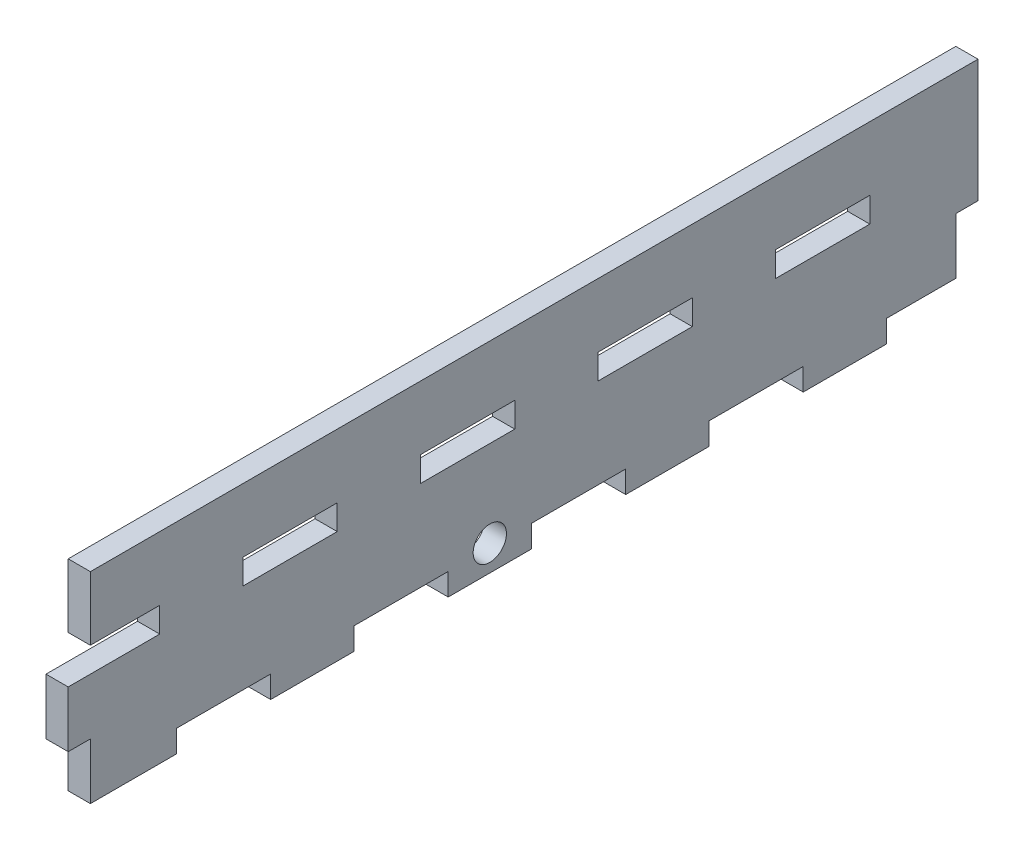
from build123d import *

# Parameters (mm, degrees)
ESQUISSE1_W             = 82
ESQUISSE1_H             = 12.11
BOSS_EXTRU_1_DEPTH      = 2
ESQUISSE2_W             = 8.5
ESQUISSE2_H             = 2.25
ENL_V_MAT_EXTRU_1_DEPTH = 42.581069992
ESQUISSE3_W             = 8.5
ESQUISSE3_H             = 2
ENL_V_MAT_EXTRU_2_DEPTH = 42.581069992
ESQUISSE4_W             = 2
ESQUISSE4_H             = 5.055
ENL_V_MAT_EXTRU_3_DEPTH = 42.581069992
ESQUISSE5_W             = 80
ESQUISSE5_H             = 6
BOSS_EXTRU_2_DEPTH      = 2
ESQUISSE6_W             = 6.25
ESQUISSE6_H             = 0.25
ESQUISSE6_W_2           = 8.5
ENL_V_MAT_EXTRU_4_DEPTH = 43.867766231
SKETCH1_R               = 1.5
CUT_EXTRUDE1_DEPTH      = 43.867766231


with BuildPart() as part:
    # Esquisse1 → Boss.-Extru.1 (new body)
    with BuildSketch(Plane(origin=(0, 0, 0), x_dir=(0, 0, -1), z_dir=(1, 0, 0))):
        with Locations((-0.0892, 0)):
            Rectangle(ESQUISSE1_W, ESQUISSE1_H)
    extrude(amount=BOSS_EXTRU_1_DEPTH)

    # Esquisse2 → Enlèv. mat.-Extru.1 (cut, through all)
    with BuildSketch(Plane(origin=(0, 0, 0), x_dir=(0, 0, -1), z_dir=(1, 0, 0))):
        with Locations((-37.0892, 5.18)):
            Rectangle(ESQUISSE2_W, ESQUISSE2_H)
        with Locations((-21.0892, 5.18)):
            Rectangle(ESQUISSE2_W, ESQUISSE2_H)
        with Locations((-5.0892, 5.18)):
            Rectangle(ESQUISSE2_W, ESQUISSE2_H)
        with Locations((10.9108, 5.18)):
            Rectangle(ESQUISSE2_W, ESQUISSE2_H)
        with Locations((26.9108, 5.18)):
            Rectangle(ESQUISSE2_W, ESQUISSE2_H)
    extrude(amount=ENL_V_MAT_EXTRU_1_DEPTH, mode=Mode.SUBTRACT)

    # Esquisse3 → Enlèv. mat.-Extru.2 (cut, through all)
    with BuildSketch(Plane(origin=(0, 0, 0), x_dir=(0, 0, -1), z_dir=(1, 0, 0))):
        with Locations((-27.0892, -5.055)):
            Rectangle(ESQUISSE3_W, ESQUISSE3_H)
        with Locations((-11.0892, -5.055)):
            Rectangle(ESQUISSE3_W, ESQUISSE3_H)
        with Locations((4.9108, -5.055)):
            Rectangle(ESQUISSE3_W, ESQUISSE3_H)
        with Locations((20.9108, -5.055)):
            Rectangle(ESQUISSE3_W, ESQUISSE3_H)
        with Locations((36.9108, -5.055)):
            Rectangle(ESQUISSE3_W, ESQUISSE3_H)
    extrude(amount=ENL_V_MAT_EXTRU_2_DEPTH, mode=Mode.SUBTRACT)

    # Esquisse4 → Enlèv. mat.-Extru.3 (cut, through all)
    with BuildSketch(Plane(origin=(2, 0, 0), x_dir=(0, 0, -1), z_dir=(1, 0, 0))):
        with Locations((-40.0892, -3.5275)):
            Rectangle(ESQUISSE4_W, ESQUISSE4_H)
        with Locations((39.9108, -1.5275)):
            Rectangle(ESQUISSE4_W, ESQUISSE4_H)
    extrude(amount=-ENL_V_MAT_EXTRU_3_DEPTH, mode=Mode.SUBTRACT)

    # Esquisse5 → Boss.-Extru.2 (add)
    with BuildSketch(Plane.ZY):
        with Locations((-0.9108, 9.055)):
            Rectangle(ESQUISSE5_W, ESQUISSE5_H)
    extrude(amount=-BOSS_EXTRU_2_DEPTH)

    # Esquisse6 → Enlèv. mat.-Extru.4 (cut, through all)
    with BuildSketch(Plane(origin=(2, 0, 0), x_dir=(0, 0, -1), z_dir=(1, 0, 0))):
        with Locations((-35.9642, 6.18)):
            Rectangle(ESQUISSE6_W, ESQUISSE6_H)
        with Locations((-21.0892, 6.18)):
            Rectangle(ESQUISSE6_W_2, ESQUISSE6_H)
        with Locations((-5.0892, 6.18)):
            Rectangle(ESQUISSE6_W_2, ESQUISSE6_H)
        with Locations((10.9108, 6.18)):
            Rectangle(ESQUISSE6_W_2, ESQUISSE6_H)
        with Locations((26.9108, 6.18)):
            Rectangle(ESQUISSE6_W_2, ESQUISSE6_H)
    extrude(amount=-ENL_V_MAT_EXTRU_4_DEPTH, mode=Mode.SUBTRACT)

    # Sketch1 → Cut-Extrude1 (cut, through all)
    with BuildSketch(Plane(origin=(2, 0, 0), x_dir=(0, 0, -1), z_dir=(1, 0, 0))):
        with Locations((-3.0892, -3.725)):
            Circle(SKETCH1_R)
    extrude(amount=-CUT_EXTRUDE1_DEPTH, mode=Mode.SUBTRACT)


solid = part.part
